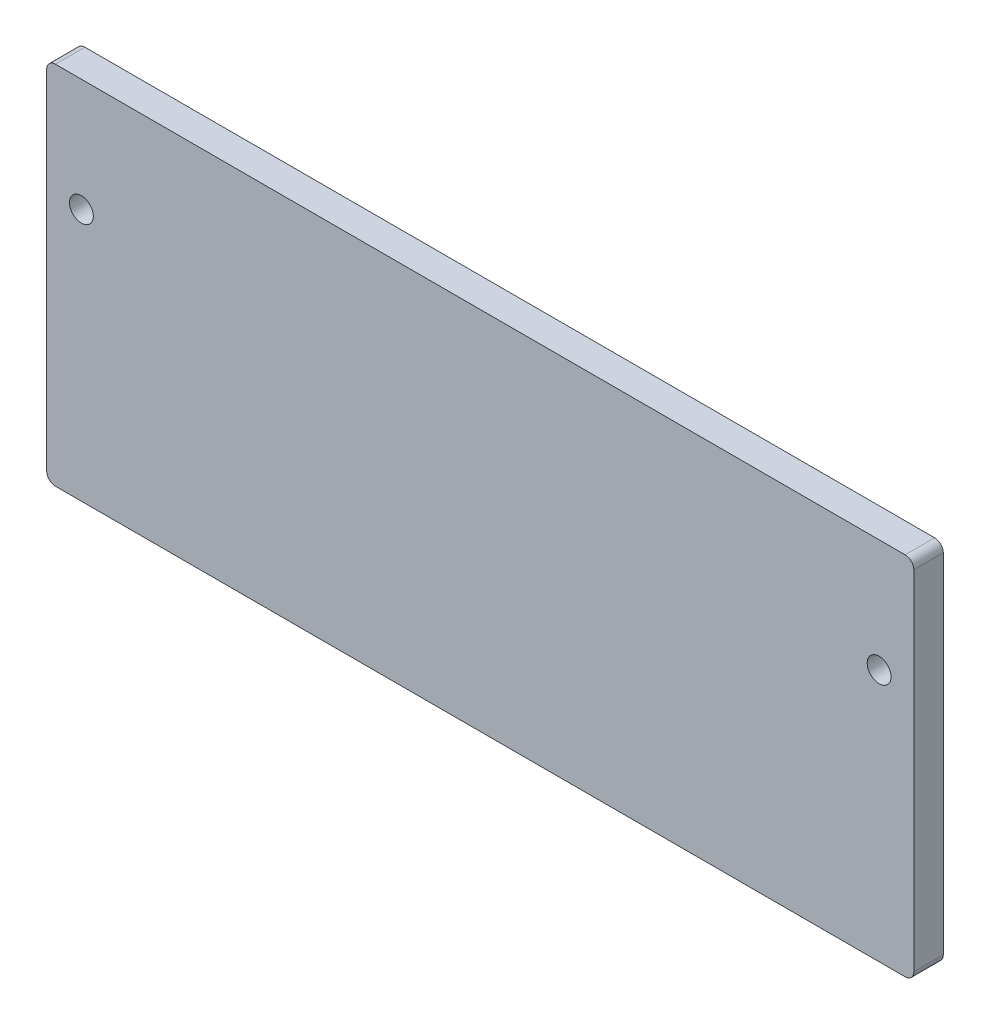
from build123d import *

# Parameters (mm, degrees)
SKETCH1_W           = 200
SKETCH1_H           = 84.3
BOSS_EXTRUDE1_DEPTH = 6.8
SKETCH2_R           = 2.75
CUT_EXTRUDE1_DEPTH  = 6.8
FILLET1_R           = 2


with BuildPart() as part:
    # Sketch1 → Boss-Extrude1 (new body)
    with BuildSketch(Plane.XY):
        Rectangle(SKETCH1_W, SKETCH1_H)
    extrude(amount=BOSS_EXTRUDE1_DEPTH)

    # Sketch2 → Cut-Extrude1 (cut)
    with BuildSketch(Plane.XY.offset(6.8)):
        with Locations((-92, 16.15)):
            Circle(SKETCH2_R)
        with Locations((92, 16.15)):
            Circle(SKETCH2_R)
    extrude(amount=-CUT_EXTRUDE1_DEPTH, mode=Mode.SUBTRACT)

    # Fillet1
    fillet1_edges = [part.edges().sort_by_distance(p)[0] for p in [
        (-100, 42.15, 3.4),
        (100, 42.15, 3.4),
        (100, -42.15, 3.4),
        (-100, -42.15, 3.4),
    ]]
    fillet(fillet1_edges, radius=FILLET1_R)


solid = part.part
